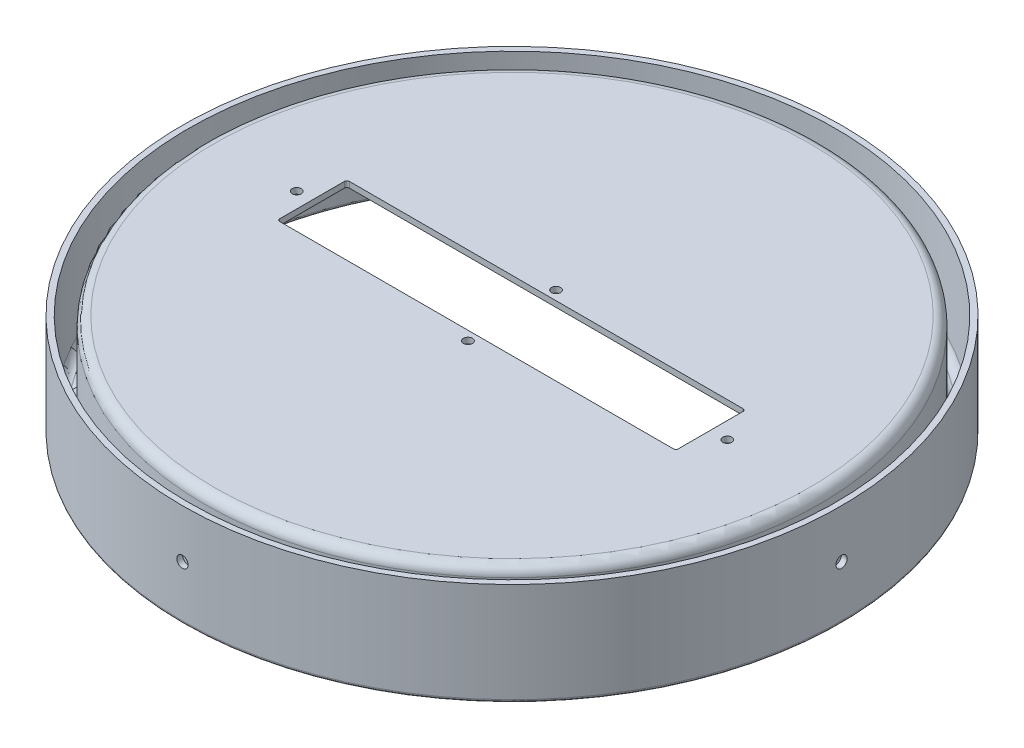
from build123d import *

# Parameters (mm, degrees)
SCHIZZO2_R                  = 1.75
TAGLIO_ESTRUSIONE1_DEPTH    = 148.437173082
RIPETIZIONECIRCOLARE1_COUNT = 2
RIPETIZIONECIRCOLARE1_ANGLE = 90
TAGLIO_ESTRUSIONE2_DEPTH    = 8.5
SCHIZZO4_R                  = 1.4
TAGLIO_ESTRUSIONE3_DEPTH    = 10
SCHIZZO5_R                  = 1.4
TAGLIO_ESTRUSIONE4_DEPTH    = 10


with BuildPart() as part:
    # Schizzo1 → Rivoluzione1 (revolve)
    with BuildSketch(Plane.XY, mode=Mode.PRIVATE) as rivoluzione1_sk:
        with BuildLine():
            Line((0, 0), (-92, 0))
            ThreePointArc((-92, 0), (-94.121320344, -0.878679656), (-95, -3))
            Line((-95, -3), (-95, -27.55))
            ThreePointArc((-95, -27.55), (-95.717588386, -29.282411614), (-97.45, -30))
            Line((-97.45, -30), (-97.55, -30))
            ThreePointArc((-97.55, -30), (-99.282411614, -29.282411614), (-100, -27.55))
            Line((-100, -27.55), (-100, 0))
            Line((-100, 0), (-101.8, 0))
            Line((-101.8, 0), (-101.8, -30.8))
            ThreePointArc((-101.8, -30.8), (-101.507106781, -31.507106781), (-100.8, -31.8))
            Line((-100.8, -31.8), (-94.2, -31.8))
            ThreePointArc((-94.2, -31.8), (-93.492893219, -31.507106781), (-93.2, -30.8))
            Line((-93.2, -30.8), (-93.2, -3))
            ThreePointArc((-93.2, -3), (-92.848528137, -2.151471863), (-92, -1.8))
            Line((-92, -1.8), (0, -1.8))
            Line((0, -1.8), (0, 0))
        make_face()
    revolve(rivoluzione1_sk.sketch.rotate(Axis((0, 0, 0), (0, -1, 0)), 270), axis=Axis((0, 0, 0), (0, -1, 0)))

    # Schizzo2 → Taglio-Estrusione1 (cut, symmetric)
    with BuildSketch(Plane(origin=(0, 0, 0), x_dir=(0, 0, -1), z_dir=(1, 0, 0))):
        with Locations((0, -15)):
            Circle(SCHIZZO2_R)
    taglio_estrusione1 = extrude(amount=TAGLIO_ESTRUSIONE1_DEPTH, both=True, mode=Mode.SUBTRACT)

    # RipetizioneCircolare1: Taglio-Estrusione1 ×2 about axis
    ripetizionecircolare1_axis = Axis((0, -30.8, 0), (0, 1, 0))
    for i in range(1, RIPETIZIONECIRCOLARE1_COUNT):
        add(taglio_estrusione1.rotate(ripetizionecircolare1_axis, i * RIPETIZIONECIRCOLARE1_ANGLE / (RIPETIZIONECIRCOLARE1_COUNT - 1)), mode=Mode.SUBTRACT)

    # Schizzo3 → Taglio-Estrusione2 (cut)
    with BuildSketch(Plane(origin=(0, 0, 0), x_dir=(1, 0, 0), z_dir=(0, 1, 0))):
        with BuildLine():
            Line((-61, 10.75), (60.612492158, 10.75))
            ThreePointArc((60.612492158, 10.75), (61.142822244, 10.530330086), (61.362492158, 10))
            Line((61.362492158, 10), (61.362492158, -10))
            ThreePointArc((61.362492158, -10), (61.142822244, -10.530330086), (60.612492158, -10.75))
            Line((60.612492158, -10.75), (-61, -10.75))
            ThreePointArc((-61, -10.75), (-61.530330086, -10.530330086), (-61.75, -10))
            Line((-61.75, -10), (-61.75, 10))
            ThreePointArc((-61.75, 10), (-61.530330086, 10.530330086), (-61, 10.75))
        make_face()
    extrude(amount=-TAGLIO_ESTRUSIONE2_DEPTH, mode=Mode.SUBTRACT)

    # Schizzo4 → Taglio-Estrusione3 (cut)
    with BuildSketch(Plane(origin=(-0.769389316, 2, -203.6), x_dir=(1, 0, 0), z_dir=(0, 1, 0))):
        with Locations(Location((0.769389316, -189.997635123, 0), (0, 0, 270))):
            Circle(SCHIZZO4_R)
        with Locations(Location((0.769389316, -217.202364877, 0), (0, 0, 270))):
            Circle(SCHIZZO4_R)
    extrude(amount=-TAGLIO_ESTRUSIONE3_DEPTH, mode=Mode.SUBTRACT)

    # Schizzo5 → Taglio-Estrusione4 (cut)
    with BuildSketch(Plane(origin=(-0.769389316, 2, -203.6), x_dir=(1, 0, 0), z_dir=(0, 1, 0))):
        with Locations(Location((-65.730610684, -203.6, 0), (0, 0, 270))):
            Circle(SCHIZZO5_R)
        with Locations(Location((67.269389316, -203.6, 0), (0, 0, 270))):
            Circle(SCHIZZO5_R)
    extrude(amount=-TAGLIO_ESTRUSIONE4_DEPTH, mode=Mode.SUBTRACT)


solid = part.part
